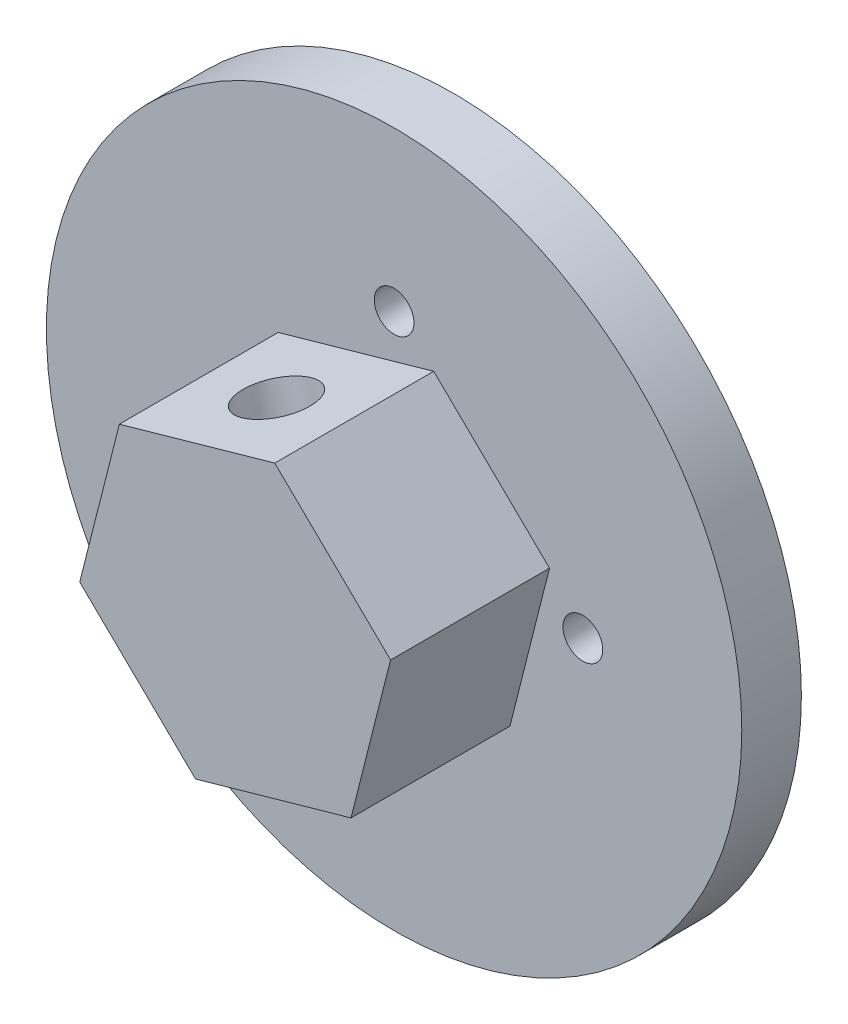
from build123d import *

# Parameters (mm, degrees)
CROQUIS1_R              = 17.5
CROQUIS1_R_2            = 1
SALIENTE_EXTRUIR1_DEPTH = 3
SALIENTE_EXTRUIR2_DEPTH = 8
CORTAR_EXTRUIR1_REACH   = 34.974
CROQUIS3_R              = 1.75


with BuildPart() as part:
    # Croquis1 → Saliente-Extruir1 (new body)
    with BuildSketch(Plane.XY):
        Circle(CROQUIS1_R)
        with Locations((0, 9.5)):
            Circle(CROQUIS1_R_2, mode=Mode.SUBTRACT)
        with Locations((9.5, 0)):
            Circle(CROQUIS1_R_2, mode=Mode.SUBTRACT)
        with Locations((0, -9.5)):
            Circle(CROQUIS1_R_2, mode=Mode.SUBTRACT)
        with Locations((-9.5, 0)):
            Circle(CROQUIS1_R_2, mode=Mode.SUBTRACT)
    extrude(amount=SALIENTE_EXTRUIR1_DEPTH)

    # Croquis2 → Saliente-Extruir2 (add)
    with BuildSketch(Plane.XY.offset(3)):
        Polygon((1.993579006, 7.881819991), (-5.829066837, 5.667400059), (-7.822645843, -2.214419931), (-1.993579006, -7.881819991), (5.829066837, -5.667400059), (7.822645843, 2.214419931), align=None)
    extrude(amount=SALIENTE_EXTRUIR2_DEPTH)

    # Croquis3 → Cortar-Extruir1 (cut, up to next)
    with BuildSketch(Plane(origin=(1.917743915, -6.774610025, 0), x_dir=(0.9621911038516526, 0.27237525524308964, 0), z_dir=(0.27237525524308964, -0.9621911038516526, 0)), mode=Mode.PRIVATE) as cortar_extruir1_sk1:
        with Locations((0, 7)):
            Circle(CROQUIS3_R)
    cortar_extruir1_tool1 = extrude(cortar_extruir1_sk1.sketch, amount=-CORTAR_EXTRUIR1_REACH, mode=Mode.PRIVATE) & part.part
    add(cortar_extruir1_tool1.solids().sort_by_distance((1.917744, -6.77461, 7))[0], mode=Mode.SUBTRACT)


solid = part.part
